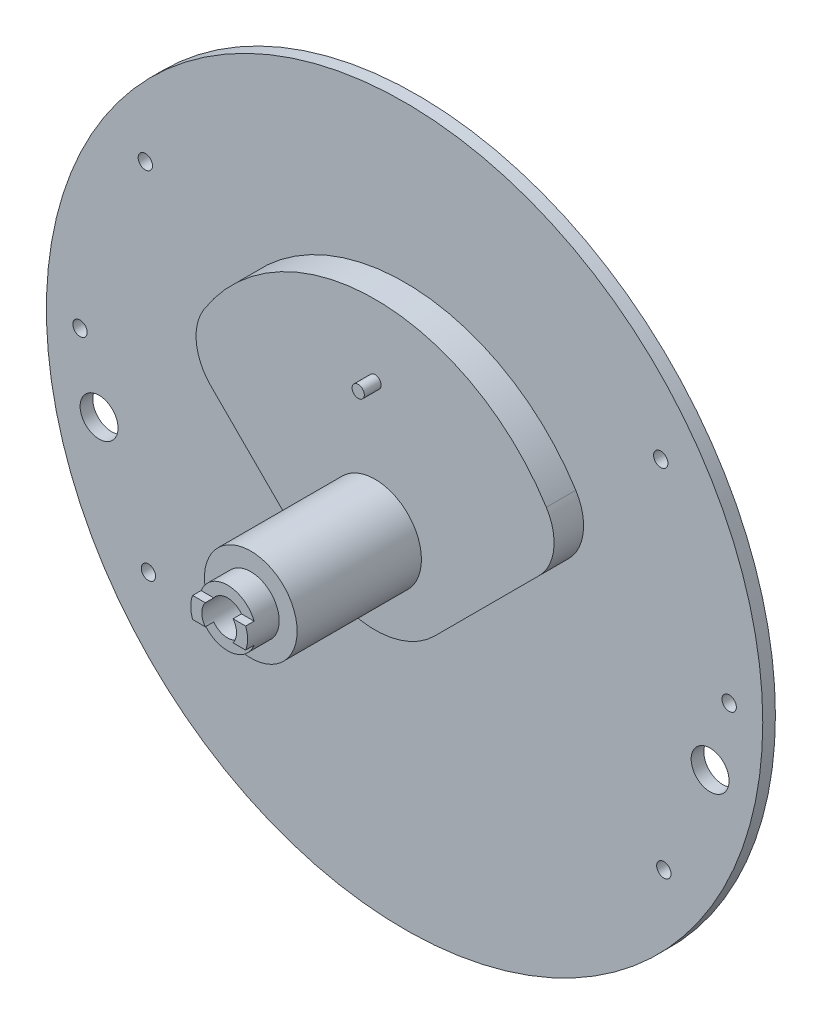
from build123d import *

# Parameters (mm, degrees)
ESQUISSE1_R                  = 85
ESQUISSE1_R_2                = 7.5
ESQUISSE1_R_3                = 4.5
BOSS_EXTRU_1_DEPTH           = 3
BOSS_EXTRU_2_DEPTH           = 4
BOSS_EXTRU_3_DEPTH           = 3
ESQUISSE5_R                  = 7.5
ENL_V_MAT_EXTRU_2_DEPTH      = 3
ENL_V_START                  = -3
ENL_V_MAT_EXTRU_3_DEPTH      = 3
ENL_V_MAT_EXTRU_6_DEPTH      = 2
ESQUISSE9_R                  = 17
ENL_V_MAT_EXTRU_4_DEPTH      = 0.25
ENL_V_MAT_EXTRU_5_DEPTH      = 10
ENL_V_MAT_EXTRU_5_DEPTH_BACK = 7.5
ESQUISSE10_OUTSIDE_W         = 220.994
ESQUISSE10_OUTSIDE_H         = 220.994
ESQUISSE10_OUTSIDE_R         = 6.75
ESQUISSE11_R                 = 1.45
BOSS_EXTRU_4_DEPTH           = 4
D_GAGEMENT_M31_D             = 3.4


with BuildPart() as part:
    # Esquisse1 → Boss.-Extru.1 (new body)
    with BuildSketch(Plane.XY):
        Circle(ESQUISSE1_R)
        Circle(ESQUISSE1_R_2, mode=Mode.SUBTRACT)
        with Locations((-72.5, -16)):
            Circle(ESQUISSE1_R_3, mode=Mode.SUBTRACT)
        with Locations((72.5, -16)):
            Circle(ESQUISSE1_R_3, mode=Mode.SUBTRACT)
    extrude(amount=BOSS_EXTRU_1_DEPTH)

    # Esquisse3 → Boss.-Extru.2 (add)
    with BuildSketch(Plane.XY.offset(3)):
        with BuildLine():
            Line((14.142135624, -14.142135624), (38.961482916, 10.677211668))
            ThreePointArc((38.961482916, 10.677211668), (42.400953744, 17.820746084), (40.634935389, 25.549990723))
            ThreePointArc((40.634935389, 25.549990723), (0, 48), (-40.634935389, 25.549990723))
            ThreePointArc((-40.634935389, 25.549990723), (-42.400953744, 17.820746084), (-38.961482916, 10.677211668))
            Line((-38.961482916, 10.677211668), (-14.142135624, -14.142135624))
            ThreePointArc((-14.142135624, -14.142135624), (0, -20), (14.142135624, -14.142135624))
        make_face()
        with BuildLine():
            Line((-36.840162572, 12.798532012), (-12.02081528, -12.02081528))
            ThreePointArc((-12.02081528, -12.02081528), (0, -17), (12.02081528, -12.02081528))
            Line((12.02081528, -12.02081528), (36.840162572, 12.798532012))
            ThreePointArc((36.840162572, 12.798532012), (39.419765694, 18.156182824), (38.095251927, 23.953116303))
            ThreePointArc((38.095251927, 23.953116303), (0, 45), (-38.095251927, 23.953116303))
            ThreePointArc((-38.095251927, 23.953116303), (-39.419765694, 18.156182824), (-36.840162572, 12.798532012))
        make_face(mode=Mode.SUBTRACT)
    extrude(amount=BOSS_EXTRU_2_DEPTH)

    # Esquisse4 → Boss.-Extru.3 (add)
    with BuildSketch(Plane.XY.offset(7)):
        with BuildLine():
            Line((-38.961482916, 10.677211668), (-14.142135624, -14.142135624))
            ThreePointArc((-14.142135624, -14.142135624), (0, -20), (14.142135624, -14.142135624))
            Line((14.142135624, -14.142135624), (38.961482916, 10.677211668))
            ThreePointArc((38.961482916, 10.677211668), (42.400953744, 17.820746084), (40.634935389, 25.549990723))
            ThreePointArc((40.634935389, 25.549990723), (0, 48), (-40.634935389, 25.549990723))
            ThreePointArc((-40.634935389, 25.549990723), (-42.400953744, 17.820746084), (-38.961482916, 10.677211668))
        make_face()
    extrude(amount=BOSS_EXTRU_3_DEPTH)

    # Esquisse5 → Enlèv. mat.-Extru.2 (cut)
    with BuildSketch(Plane(origin=(0, 0, 7), x_dir=(-1, 0, 0), z_dir=(0, 0, -1))):
        Circle(ESQUISSE5_R)
    extrude(amount=-ENL_V_MAT_EXTRU_2_DEPTH, mode=Mode.SUBTRACT)

    # Esquisse6 → Enlèv. mat.-Extru.3 (cut)
    with BuildSketch(Plane.XY.offset(3).offset(ENL_V_START)):
        with BuildLine():
            Line((-36.840162572, 12.798532012), (-12.02081528, -12.02081528))
            ThreePointArc((-12.02081528, -12.02081528), (0, -17), (12.02081528, -12.02081528))
            Line((12.02081528, -12.02081528), (36.840162572, 12.798532012))
            ThreePointArc((36.840162572, 12.798532012), (39.419765694, 18.156182824), (38.095251927, 23.953116303))
            ThreePointArc((38.095251927, 23.953116303), (0, 45), (-38.095251927, 23.953116303))
            ThreePointArc((-38.095251927, 23.953116303), (-39.419765694, 18.156182824), (-36.840162572, 12.798532012))
        make_face()
    extrude(amount=ENL_V_MAT_EXTRU_3_DEPTH, mode=Mode.SUBTRACT)

    # Esquisse7 → Révolution1 (revolve)
    with BuildSketch(Plane(origin=(0, 0, 0), x_dir=(0, 0, -1), z_dir=(1, 0, 0))):
        Polygon((-7, -7.5), (-38.5, -5.12), (-38.5, -4.12), (-47, -4.12), (-47, -11), (-7, -11), align=None)
    revolve(axis=Axis((0, 0, 0), (0, 0, 1)))

    # Esquisse8 → Enlèv. mat.-Extru.6 (cut)
    with BuildSketch(Plane.XY.offset(47)):
        with BuildLine():
            Line((3.293747865, 2.475), (10.717946398, 2.475))
            ThreePointArc((10.717946398, 2.475), (0, 11), (-10.717946398, 2.475))
            Line((-10.717946398, 2.475), (-3.293747865, 2.475))
            ThreePointArc((-3.293747865, 2.475), (0, 4.12), (3.293747865, 2.475))
        make_face()
        with BuildLine():
            Line((-10.717946398, -2.475), (-3.293747865, -2.475))
            ThreePointArc((-3.293747865, -2.475), (0, -4.12), (3.293747865, -2.475))
            Line((3.293747865, -2.475), (10.717946398, -2.475))
            ThreePointArc((10.717946398, -2.475), (0, -11), (-10.717946398, -2.475))
        make_face()
    extrude(amount=-ENL_V_MAT_EXTRU_6_DEPTH, mode=Mode.SUBTRACT)

    # Esquisse9 → Enlèv. mat.-Extru.4 (cut)
    with BuildSketch(Plane(origin=(0, 0, 7), x_dir=(-1, 0, 0), z_dir=(0, 0, -1))):
        Circle(ESQUISSE9_R)
    extrude(amount=-ENL_V_MAT_EXTRU_4_DEPTH, mode=Mode.SUBTRACT)

    # Esquisse10 outside → Enlèv. mat.-Extru.5 (cut, two sides: drawn at the far end of the back side and taken through both)
    with BuildSketch(Plane.XY.offset(47).offset(-ENL_V_MAT_EXTRU_5_DEPTH_BACK)):
        Rectangle(ESQUISSE10_OUTSIDE_W, ESQUISSE10_OUTSIDE_H)
        Circle(ESQUISSE10_OUTSIDE_R, mode=Mode.SUBTRACT)
    extrude(amount=ENL_V_MAT_EXTRU_5_DEPTH + ENL_V_MAT_EXTRU_5_DEPTH_BACK, mode=Mode.SUBTRACT)

    # Esquisse11 → Boss.-Extru.4 (add)
    with BuildSketch(Plane.XY.offset(10)):
        with Locations((0, 31.05)):
            Circle(ESQUISSE11_R)
    extrude(amount=BOSS_EXTRU_4_DEPTH)

    # Dégagement M31 (through all)
    with Locations(Plane.XY.offset(3)):
        with Locations((60.78495979, 42), (77.019852204, 0), (61.519852204, -42), (-60.78495979, -42), (-77.019852204, 0), (-61.519852204, 42)):
            Hole(D_GAGEMENT_M31_D / 2)


solid = part.part
